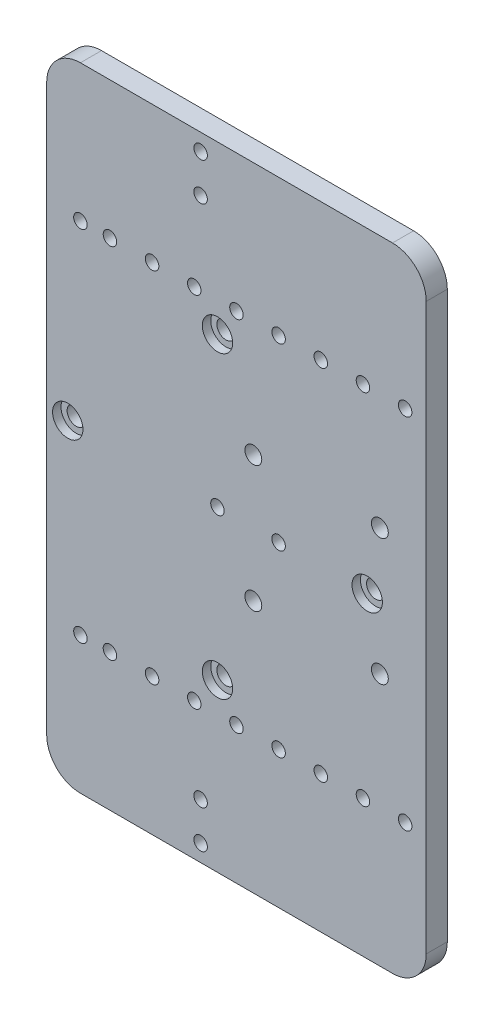
from build123d import *

# Parameters (mm, degrees)
SKETCH_1_W          = 90
SKETCH_1_H          = 150
SKETCH_1_R          = 2
SKETCH_1_R_2        = 2.15
SKETCH_1_R_3        = 1.6
EXTRUDE_1_DEPTH     = 5
FILLET_1_R          = 8
SKETCH_2_R          = 3.6
CUT_EXTRUDE_1_DEPTH = 2


with BuildPart() as part:
    # 草图1 → 凸台-拉伸1 (new body)
    with BuildSketch(Plane.XY):
        with Locations((45, -75)):
            Rectangle(SKETCH_1_W, SKETCH_1_H)
        with Locations((79, -60)):
            Circle(SKETCH_1_R, mode=Mode.SUBTRACT)
        with Locations((79, -90)):
            Circle(SKETCH_1_R, mode=Mode.SUBTRACT)
        with Locations((49, -60)):
            Circle(SKETCH_1_R, mode=Mode.SUBTRACT)
        with Locations((49, -90)):
            Circle(SKETCH_1_R, mode=Mode.SUBTRACT)
        with Locations((40.5, -39.5)):
            Circle(SKETCH_1_R_2, mode=Mode.SUBTRACT)
        with Locations((40.5, -110.5)):
            Circle(SKETCH_1_R_2, mode=Mode.SUBTRACT)
        with Locations((76, -75)):
            Circle(SKETCH_1_R_2, mode=Mode.SUBTRACT)
        with Locations((5, -75)):
            Circle(SKETCH_1_R_2, mode=Mode.SUBTRACT)
        with Locations((85, -117.5)):
            Circle(SKETCH_1_R_3, mode=Mode.SUBTRACT)
        with Locations((75, -117.5)):
            Circle(SKETCH_1_R_3, mode=Mode.SUBTRACT)
        with Locations((65, -117.5)):
            Circle(SKETCH_1_R_3, mode=Mode.SUBTRACT)
        with Locations((55, -117.5)):
            Circle(SKETCH_1_R_3, mode=Mode.SUBTRACT)
        with Locations((45, -117.5)):
            Circle(SKETCH_1_R_3, mode=Mode.SUBTRACT)
        with Locations((85, -32.5)):
            Circle(SKETCH_1_R_3, mode=Mode.SUBTRACT)
        with Locations((75, -32.5)):
            Circle(SKETCH_1_R_3, mode=Mode.SUBTRACT)
        with Locations((65, -32.5)):
            Circle(SKETCH_1_R_3, mode=Mode.SUBTRACT)
        with Locations((55, -32.5)):
            Circle(SKETCH_1_R_3, mode=Mode.SUBTRACT)
        with Locations((45, -32.5)):
            Circle(SKETCH_1_R_3, mode=Mode.SUBTRACT)
        with Locations((35, -117.5)):
            Circle(SKETCH_1_R_3, mode=Mode.SUBTRACT)
        with Locations((25, -117.5)):
            Circle(SKETCH_1_R_3, mode=Mode.SUBTRACT)
        with Locations((15, -117.5)):
            Circle(SKETCH_1_R_3, mode=Mode.SUBTRACT)
        with Locations((35, -32.5)):
            Circle(SKETCH_1_R_3, mode=Mode.SUBTRACT)
        with Locations((25, -32.5)):
            Circle(SKETCH_1_R_3, mode=Mode.SUBTRACT)
        with Locations((15, -32.5)):
            Circle(SKETCH_1_R_3, mode=Mode.SUBTRACT)
        with Locations((8, -117.5)):
            Circle(SKETCH_1_R_3, mode=Mode.SUBTRACT)
        with Locations((8, -32.5)):
            Circle(SKETCH_1_R_3, mode=Mode.SUBTRACT)
        with Locations((36.5, -4)):
            Circle(SKETCH_1_R_3, mode=Mode.SUBTRACT)
        with Locations((36.5, -13)):
            Circle(SKETCH_1_R_3, mode=Mode.SUBTRACT)
        with Locations((36.5, -137)):
            Circle(SKETCH_1_R_3, mode=Mode.SUBTRACT)
        with Locations((36.5, -146)):
            Circle(SKETCH_1_R_3, mode=Mode.SUBTRACT)
        with Locations((55, -75)):
            Circle(SKETCH_1_R_3, mode=Mode.SUBTRACT)
        with Locations((40.5, -75)):
            Circle(SKETCH_1_R_3, mode=Mode.SUBTRACT)
    extrude(amount=EXTRUDE_1_DEPTH)

    # 圆角1
    fillet_1_edges = [part.edges().sort_by_distance(p)[0] for p in [
        (0, 0, 2.5),
        (90, 0, 2.5),
        (90, -150, 2.5),
        (0, -150, 2.5),
    ]]
    fillet(fillet_1_edges, radius=FILLET_1_R)

    # 草图2 → 切除-拉伸1 (cut)
    with BuildSketch(Plane.XY.offset(5)):
        with Locations((40.5, -39.5)):
            Circle(SKETCH_2_R)
        with Locations((76, -75)):
            Circle(SKETCH_2_R)
        with Locations((5, -75)):
            Circle(SKETCH_2_R)
        with Locations((40.5, -110.5)):
            Circle(SKETCH_2_R)
    extrude(amount=-CUT_EXTRUDE_1_DEPTH, mode=Mode.SUBTRACT)


solid = part.part
